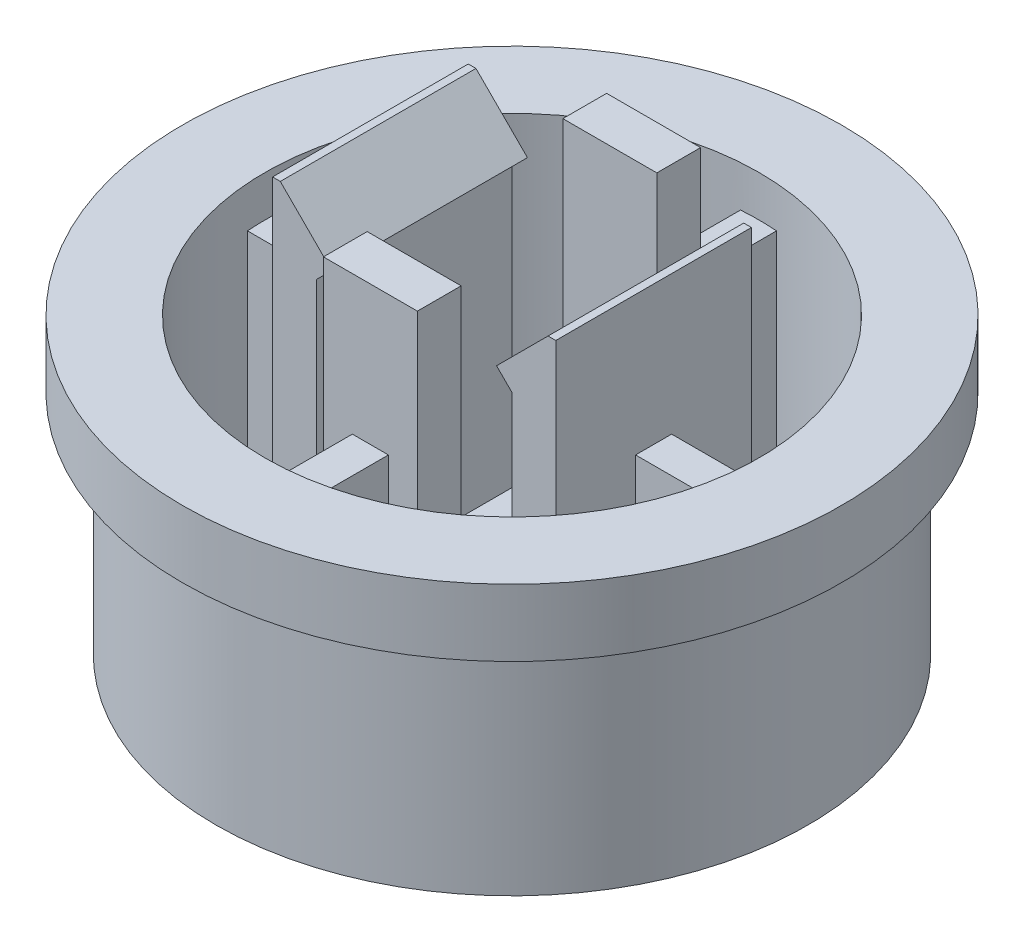
from build123d import *

# Parameters (mm, degrees)
SKETCH_1_R          = 5.75
EXTRUDE_1_DEPTH     = 0.9
SKETCH_2_R          = 5.75
SKETCH_2_R_2        = 4.8
EXTRUDE_2_DEPTH     = 3.5
SKETCH_3_R          = 6.4
SKETCH_3_R_2        = 4.8
EXTRUDE_3_DEPTH     = 1.3
SKETCH_4_W          = 0.85
SKETCH_4_H          = 3.8
SKETCH_4_W_2        = 1.824882422
SKETCH_4_H_2        = 0.85
EXTRUDE_4_DEPTH     = 6.7
EXTRUDE_5_DEPTH     = 3.8
CUT_EXTRUDE_1_REACH = 14.946
EXTRUDE_6_DEPTH     = 4


with BuildPart() as part:
    # Эскиз1 → Бобышка-Вытянуть1 (new body)
    with BuildSketch(Plane(origin=(0, 0, 0), x_dir=(1, 0, 0), z_dir=(0, 1, 0))):
        with Locations(Location((0, 0, 0), (0, 0, 270))):
            Circle(SKETCH_1_R)
    extrude(amount=EXTRUDE_1_DEPTH)

    # Эскиз2 → Бобышка-Вытянуть2 (add)
    with BuildSketch(Plane(origin=(0, 0.9, 0), x_dir=(1, 0, 0), z_dir=(0, 1, 0))):
        with Locations(Location((0, 0, 0), (0, 0, 270))):
            Circle(SKETCH_2_R)
        with Locations(Location((0, 0, 0), (0, 0, 270))):
            Circle(SKETCH_2_R_2, mode=Mode.SUBTRACT)
    extrude(amount=EXTRUDE_2_DEPTH)

    # Эскиз3 → Бобышка-Вытянуть3 (add)
    with BuildSketch(Plane(origin=(0, 4.4, 0), x_dir=(1, 0, 0), z_dir=(0, 1, 0))):
        with Locations(Location((0, 0, 0), (0, 0, 270))):
            Circle(SKETCH_3_R)
        with Locations(Location((0, 0, 0), (0, 0, 270))):
            Circle(SKETCH_3_R_2, mode=Mode.SUBTRACT)
    extrude(amount=EXTRUDE_3_DEPTH)

    # Эскиз4 → Бобышка-Вытянуть4 (add)
    with BuildSketch(Plane(origin=(0, 0.9, 0), x_dir=(1, 0, 0), z_dir=(0, 1, 0))):
        with Locations((-2.325, 0)):
            Rectangle(SKETCH_4_W, SKETCH_4_H)
        with Locations((2.325, 0)):
            Rectangle(SKETCH_4_W, SKETCH_4_H)
        with Locations((0, 2.325)):
            Rectangle(SKETCH_4_W_2, SKETCH_4_H_2)
        with Locations((0, -2.325)):
            Rectangle(SKETCH_4_W_2, SKETCH_4_H_2)
    extrude(amount=EXTRUDE_4_DEPTH)

    # Эскиз5 → Бобышка-Вытянуть5 (add)
    with BuildSketch(Plane(origin=(0, 0, -1.9), x_dir=(-1, 0, 0), z_dir=(0, 0, -1))):
        Polygon((1.9, 6.3), (1.6, 6.6), (2.6, 7.6), align=None)
        Polygon((-1.9, 6.3), (-1.6, 6.6), (-2.6, 7.6), align=None)
    extrude(amount=-EXTRUDE_5_DEPTH)

    # Эскиз6 → Вырез-Вытянуть1 (cut, up to next)
    with BuildSketch(Plane(origin=(0, 0, -1.9), x_dir=(-1, 0, 0), z_dir=(0, 0, -1)), mode=Mode.PRIVATE) as cut_extrude_1_sk1:
        Polygon((1.9, 6.9), (2.6, 7.6), (1.9, 7.6), align=None)
    cut_extrude_1_tool1 = extrude(cut_extrude_1_sk1.sketch, amount=-CUT_EXTRUDE_1_REACH, mode=Mode.PRIVATE) & part.part
    # Эскиз6 → Вырез-Вытянуть1 (cut, up to next)
    with BuildSketch(Plane(origin=(0, 0, -1.9), x_dir=(-1, 0, 0), z_dir=(0, 0, -1)), mode=Mode.PRIVATE) as cut_extrude_1_sk2:
        Polygon((-1.9, 6.9), (-2.6, 7.6), (-1.9, 7.6), align=None)
    cut_extrude_1_tool2 = extrude(cut_extrude_1_sk2.sketch, amount=-CUT_EXTRUDE_1_REACH, mode=Mode.PRIVATE) & part.part
    add(cut_extrude_1_tool1.solids().sort_by_distance((-2.133333, 7.366667, -1.9))[0], mode=Mode.SUBTRACT)
    add(cut_extrude_1_tool2.solids().sort_by_distance((2.133333, 7.366667, -1.9))[0], mode=Mode.SUBTRACT)

    # Эскиз7 → Бобышка-Вытянуть6 (add)
    with BuildSketch(Plane(origin=(0, 0.9, 0), x_dir=(1, 0, 0), z_dir=(0, 1, 0))):
        with BuildLine():
            Line((-0.35, -2.75), (0.35, -2.75))
            Line((0.35, -2.75), (0.35, -4.787222577))
            ThreePointArc((0.35, -4.787222577), (0, -4.8), (-0.35, -4.787222577))
            Line((-0.35, -4.787222577), (-0.35, -2.75))
        make_face()
        with BuildLine():
            Line((4.787222577, -0.35), (2.75, -0.35))
            Line((2.75, -0.35), (2.75, 0.35))
            Line((2.75, 0.35), (4.787222577, 0.35))
            ThreePointArc((4.787222577, 0.35), (4.8, 0), (4.787222577, -0.35))
        make_face()
        with BuildLine():
            Line((0.35, 2.75), (0.35, 4.787222577))
            ThreePointArc((0.35, 4.787222577), (0, 4.8), (-0.35, 4.787222577))
            Line((-0.35, 4.787222577), (-0.35, 2.75))
            Line((-0.35, 2.75), (0.35, 2.75))
        make_face()
        with BuildLine():
            Line((-2.75, -0.35), (-4.787222577, -0.35))
            ThreePointArc((-4.787222577, -0.35), (-4.8, 0), (-4.787222577, 0.35))
            Line((-4.787222577, 0.35), (-2.75, 0.35))
            Line((-2.75, 0.35), (-2.75, -0.35))
        make_face()
    extrude(amount=EXTRUDE_6_DEPTH)


solid = part.part
